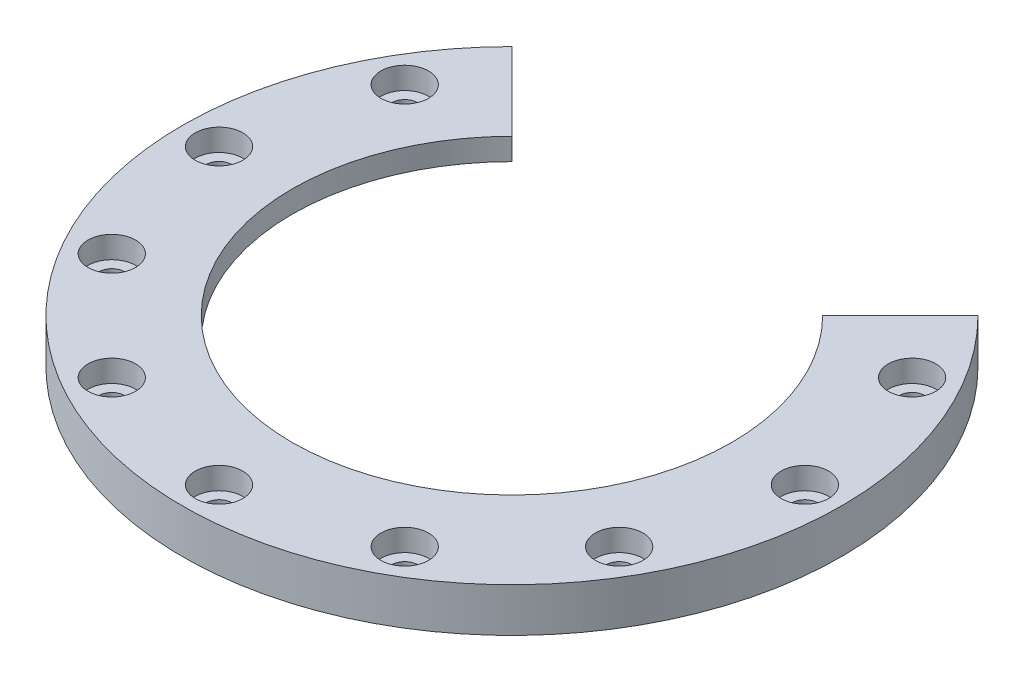
from build123d import *

# Parameters (mm, degrees)
SKETCH1_R           = 45
SKETCH1_R_2         = 30
SKETCH1_R_3         = 1.75
BOSS_EXTRUDE1_DEPTH = 6
SKETCH2_R           = 35.5
CUT_EXTRUDE1_DEPTH  = 3
SKETCH3_R           = 3.25
CUT_EXTRUDE2_DEPTH  = 3
CUT_EXTRUDE4_DEPTH  = 10


with BuildPart() as part:
    # Sketch1 → Boss-Extrude1 (new body)
    with BuildSketch(Plane(origin=(0, 0, 0), x_dir=(1, 0, 0), z_dir=(0, 1, 0))):
        with Locations(Location((0, 0, 0), (0, 0, 270))):
            Circle(SKETCH1_R)
        with Locations(Location((0, 0, 0), (0, 0, 270))):
            Circle(SKETCH1_R_2, mode=Mode.SUBTRACT)
        with Locations(Location((0, 40, 0), (0, 0, 270))):
            Circle(SKETCH1_R_3, mode=Mode.SUBTRACT)
        with Locations(Location((20, 34.641016151, 0), (0, 0, 270))):
            Circle(SKETCH1_R_3, mode=Mode.SUBTRACT)
        with Locations(Location((34.641016151, 20, 0), (0, 0, 270))):
            Circle(SKETCH1_R_3, mode=Mode.SUBTRACT)
        with Locations(Location((40, 0, 0), (0, 0, 270))):
            Circle(SKETCH1_R_3, mode=Mode.SUBTRACT)
        with Locations(Location((34.641016151, -20, 0), (0, 0, 270))):
            Circle(SKETCH1_R_3, mode=Mode.SUBTRACT)
        with Locations(Location((20, -34.641016151, 0), (0, 0, 270))):
            Circle(SKETCH1_R_3, mode=Mode.SUBTRACT)
        with Locations(Location((0, -40, 0), (0, 0, 270))):
            Circle(SKETCH1_R_3, mode=Mode.SUBTRACT)
        with Locations(Location((-20, -34.641016151, 0), (0, 0, 270))):
            Circle(SKETCH1_R_3, mode=Mode.SUBTRACT)
        with Locations(Location((-34.641016151, -20, 0), (0, 0, 270))):
            Circle(SKETCH1_R_3, mode=Mode.SUBTRACT)
        with Locations(Location((-40, 0, 0), (0, 0, 270))):
            Circle(SKETCH1_R_3, mode=Mode.SUBTRACT)
        with Locations(Location((-34.641016151, 20, 0), (0, 0, 270))):
            Circle(SKETCH1_R_3, mode=Mode.SUBTRACT)
        with Locations(Location((-20, 34.641016151, 0), (0, 0, 270))):
            Circle(SKETCH1_R_3, mode=Mode.SUBTRACT)
    extrude(amount=BOSS_EXTRUDE1_DEPTH)

    # Sketch2 → Cut-Extrude1 (cut)
    with BuildSketch(Plane.XZ):
        with Locations(Location((0, 0, 0), (0, 0, 270))):
            Circle(SKETCH2_R)
    extrude(amount=-CUT_EXTRUDE1_DEPTH, mode=Mode.SUBTRACT)

    # Sketch3 → Cut-Extrude2 (cut)
    with BuildSketch(Plane(origin=(0, 6, 0), x_dir=(1, 0, 0), z_dir=(0, 1, 0))):
        with Locations(Location((40, 0, 0), (0, 0, 270))):
            Circle(SKETCH3_R)
        with Locations(Location((34.641016151, -20, 0), (0, 0, 270))):
            Circle(SKETCH3_R)
        with Locations(Location((20, -34.641016151, 0), (0, 0, 270))):
            Circle(SKETCH3_R)
        with Locations(Location((0, -40, 0), (0, 0, 270))):
            Circle(SKETCH3_R)
        with Locations(Location((-20, -34.641016151, 0), (0, 0, 270))):
            Circle(SKETCH3_R)
        with Locations(Location((-34.641016151, -20, 0), (0, 0, 270))):
            Circle(SKETCH3_R)
        with Locations(Location((-40, 0, 0), (0, 0, 270))):
            Circle(SKETCH3_R)
        with Locations(Location((-34.641016151, 20, 0), (0, 0, 270))):
            Circle(SKETCH3_R)
        with Locations(Location((-20, 34.641016151, 0), (0, 0, 270))):
            Circle(SKETCH3_R)
        with Locations(Location((0, 40, 0), (0, 0, 270))):
            Circle(SKETCH3_R)
        with Locations(Location((20, 34.641016151, 0), (0, 0, 270))):
            Circle(SKETCH3_R)
        with Locations(Location((34.641016151, 20, 0), (0, 0, 270))):
            Circle(SKETCH3_R)
    extrude(amount=-CUT_EXTRUDE2_DEPTH, mode=Mode.SUBTRACT)

    # Sketch5 → Cut-Extrude4 (cut)
    with BuildSketch(Plane(origin=(0, 0, 0), x_dir=(1, 0, 0), z_dir=(0, 1, 0))):
        with BuildLine():
            Line((38.890872965, 38.890872965), (0, 0))
            Line((0, 0), (-38.890872965, 38.890872965))
            ThreePointArc((-38.890872965, 38.890872965), (0, 55), (38.890872965, 38.890872965))
        make_face()
    extrude(amount=CUT_EXTRUDE4_DEPTH, mode=Mode.SUBTRACT)


solid = part.part
